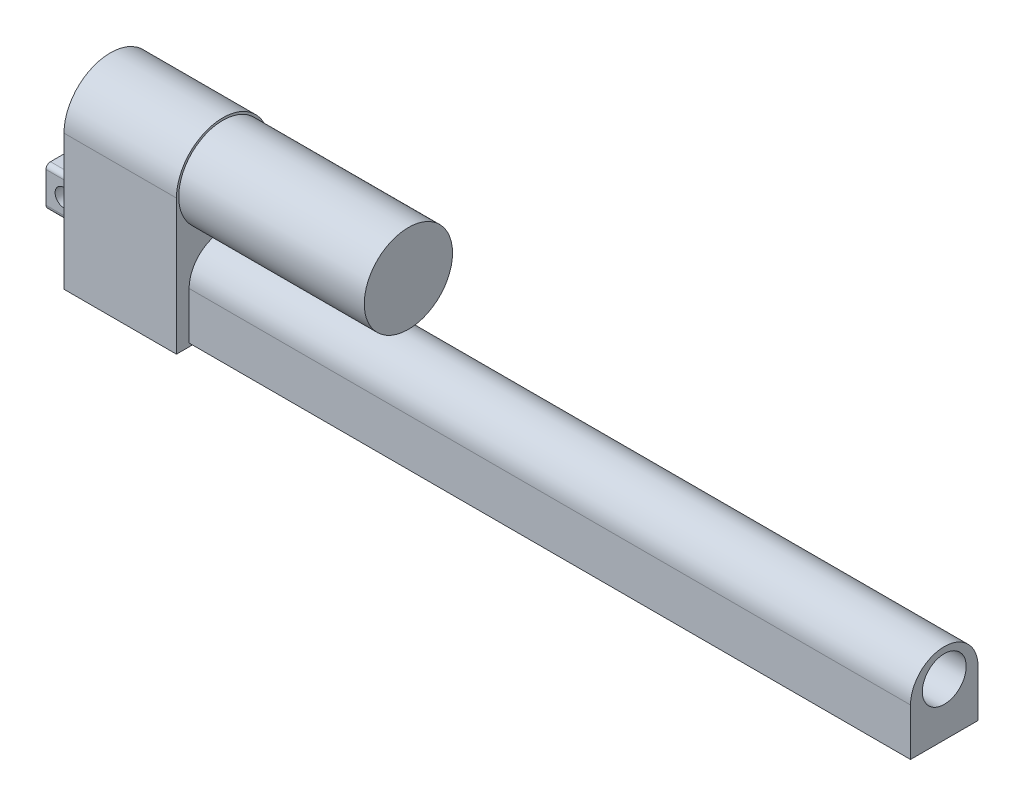
from build123d import *

# Parameters (mm, degrees)
BOSS_EXTRUDE1_DEPTH = 50.8
SKETCH2_R           = 19.939
BOSS_EXTRUDE2_DEPTH = 83.82
SKETCH3_W           = 30.48
SKETCH3_H           = 21.336
BOSS_EXTRUDE3_DEPTH = 325.882
SKETCH4_W           = 18.034
SKETCH4_H           = 18.034
BOSS_EXTRUDE4_DEPTH = 20.066
FILLET2_R           = 2.032
SKETCH5_R           = 4.0132
CUT_EXTRUDE1_DEPTH  = 383.778358162
SKETCH6_R           = 9.906
CUT_EXTRUDE2_DEPTH  = 317.5


with BuildPart() as part:
    # Sketch1 → Boss-Extrude1 (new body)
    with BuildSketch(Plane(origin=(0, 0, 0), x_dir=(0, 0, -1), z_dir=(1, 0, 0))):
        with BuildLine():
            Line((-20.955, 0), (-20.955, -61.087))
            Line((-20.955, -61.087), (20.955, -61.087))
            Line((20.955, -61.087), (20.955, 0))
            ThreePointArc((20.955, 0), (0, 20.955), (-20.955, 0))
        make_face()
    extrude(amount=BOSS_EXTRUDE1_DEPTH)

    # Sketch2 → Boss-Extrude2 (add)
    with BuildSketch(Plane(origin=(50.8, 0, 0), x_dir=(0, 0, -1), z_dir=(1, 0, 0))):
        Circle(SKETCH2_R)
    extrude(amount=BOSS_EXTRUDE2_DEPTH)

    # Sketch3 → Boss-Extrude3 (add)
    with BuildSketch(Plane(origin=(50.8, 0, 0), x_dir=(0, 0, -1), z_dir=(1, 0, 0))):
        with BuildLine():
            Line((-15.24, -38.227), (15.24, -38.227))
            ThreePointArc((15.24, -38.227), (0, -22.987), (-15.24, -38.227))
        make_face()
        with Locations((0, -48.895)):
            Rectangle(SKETCH3_W, SKETCH3_H)
    extrude(amount=BOSS_EXTRUDE3_DEPTH)

    # Sketch4 → Boss-Extrude4 (add)
    with BuildSketch(Plane.ZY):
        with Locations((0, -37.211)):
            Rectangle(SKETCH4_W, SKETCH4_H)
    extrude(amount=BOSS_EXTRUDE4_DEPTH)

    # Fillet2
    fillet2_edges = [part.edges().sort_by_distance(p)[0] for p in [
        (-10.033, -28.194, -9.017),
        (-10.033, -46.228, -9.017),
        (-10.033, -46.228, 9.017),
        (-10.033, -28.194, 9.017),
    ]]
    fillet(fillet2_edges, radius=FILLET2_R)

    # Sketch5 → Cut-Extrude1 (cut, through all)
    with BuildSketch(Plane.XY.offset(9.017)):
        with Locations((-11.938, -37.211)):
            Circle(SKETCH5_R)
    extrude(amount=-CUT_EXTRUDE1_DEPTH, mode=Mode.SUBTRACT)

    # Sketch6 → Cut-Extrude2 (cut)
    with BuildSketch(Plane(origin=(376.682, 0, 0), x_dir=(0, 0, -1), z_dir=(1, 0, 0))):
        with Locations((0, -35.687)):
            Circle(SKETCH6_R)
    extrude(amount=-CUT_EXTRUDE2_DEPTH, mode=Mode.SUBTRACT)


solid = part.part
